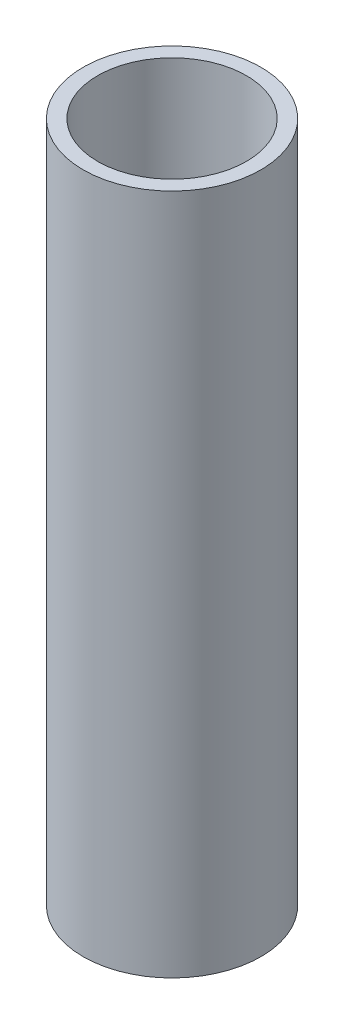
from build123d import *

# Parameters (mm, degrees)
SKETCH1_R           = 24.13
SKETCH1_R_2         = 20.193
BOSS_EXTRUDE1_DEPTH = 185


with BuildPart() as part:
    # Sketch1 → Boss-Extrude1 (new body)
    with BuildSketch(Plane(origin=(0, 0, 0), x_dir=(1, 0, 0), z_dir=(0, 1, 0))):
        with Locations(Location((0, 0, 0), (0, 0, 270))):
            Circle(SKETCH1_R)
        with Locations(Location((0, 0, 0), (0, 0, 270))):
            Circle(SKETCH1_R_2, mode=Mode.SUBTRACT)
    extrude(amount=BOSS_EXTRUDE1_DEPTH)


solid = part.part
